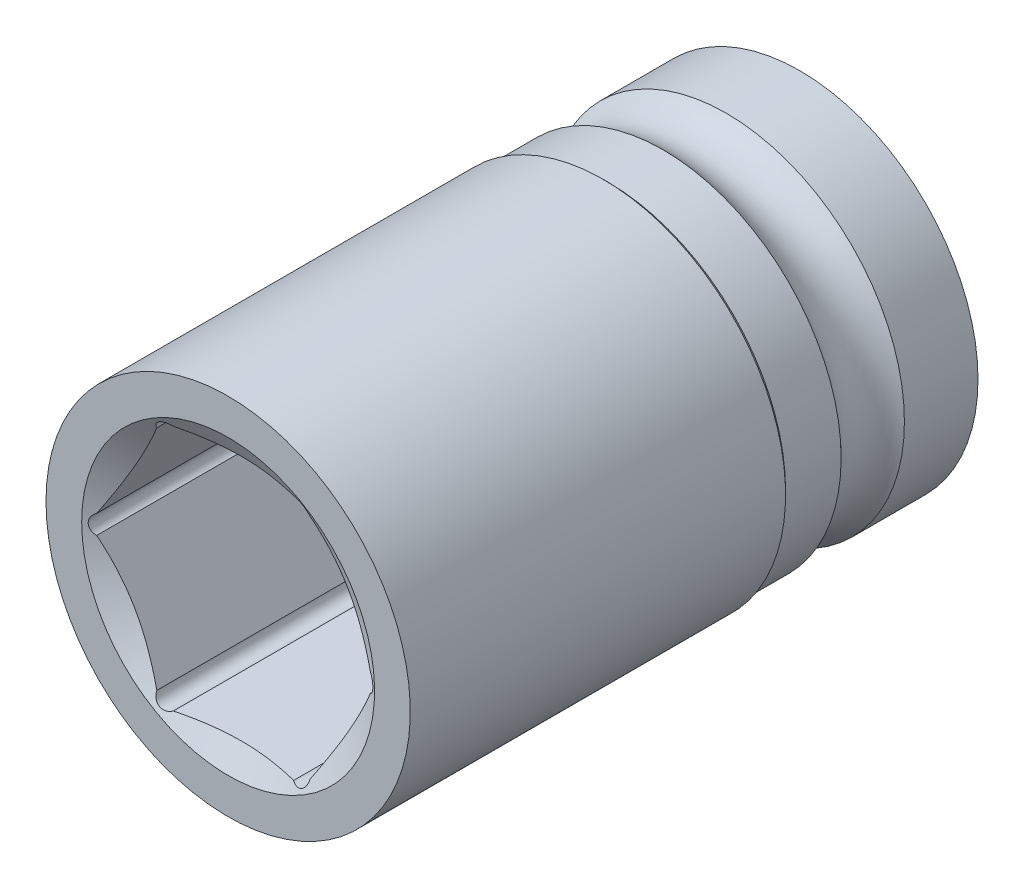
from build123d import *

# Parameters (mm, degrees)
CUT_EXTRUDE1_DEPTH = 33.1
SKETCH3_R          = 10
CUT_EXTRUDE2_DEPTH = 30
CUT_EXTRUDE3_DEPTH = 31.3
SKETCH5_R          = 15
CUT_EXTRUDE4_DEPTH = 8


with BuildPart() as part:
    # Sketch1 → Revolve1 (revolve)
    with BuildSketch(Plane(origin=(0, 0, 0), x_dir=(0, 0, -1), z_dir=(1, 0, 0)), mode=Mode.PRIVATE) as revolve1_sk:
        with BuildLine():
            Line((0, 24.75), (0, 19.9))
            Line((0, 19.9), (11.489270357, 0))
            Line((11.489270357, 0), (66.730344885, 0))
            Line((66.730344885, 0), (77.7, 19))
            Line((77.7, 19), (77.7, 24.2))
            Line((77.7, 24.2), (67.7, 24.2))
            ThreePointArc((67.7, 24.2), (63.4, 22.275), (59.1, 24.2))
            Line((59.1, 24.2), (51.55, 24.2))
            Line((51.55, 24.2), (51, 24.75))
            Line((51, 24.75), (0, 24.75))
        make_face()
    revolve(revolve1_sk.sketch.rotate(Axis((0, 0, 0), (0, 0, 1)), 90), axis=Axis((0, 0, 0), (0, 0, 1)))

    # Sketch2 → Cut-Extrude1 (cut)
    with BuildSketch(Plane.XY):
        with BuildLine():
            Line((-10.420617009, 15.450961894), (-18.591234018, 1.299038106))
            ThreePointArc((-18.591234018, 1.299038106), (-19.341234018, 0), (-18.591234018, -1.299038106))
            Line((-18.591234018, -1.299038106), (-10.420617009, -15.450961894))
            ThreePointArc((-10.420617009, -15.450961894), (-9.670617009, -16.75), (-8.170617009, -16.75))
            Line((-8.170617009, -16.75), (8.170617009, -16.75))
            ThreePointArc((8.170617009, -16.75), (9.670617009, -16.75), (10.420617009, -15.450961894))
            Line((10.420617009, -15.450961894), (18.591234018, -1.299038106))
            ThreePointArc((18.591234018, -1.299038106), (19.341234018, 0), (18.591234018, 1.299038106))
            Line((18.591234018, 1.299038106), (10.420617009, 15.450961894))
            ThreePointArc((10.420617009, 15.450961894), (9.670617009, 16.75), (8.170617009, 16.75))
            Line((8.170617009, 16.75), (-8.170617009, 16.75))
            ThreePointArc((-8.170617009, 16.75), (-9.670617009, 16.75), (-10.420617009, 15.450961894))
        make_face()
    extrude(amount=-CUT_EXTRUDE1_DEPTH, mode=Mode.SUBTRACT)

    # Sketch3 → Cut-Extrude2 (cut)
    with BuildSketch(Plane.XY.offset(-33.1)):
        Circle(SKETCH3_R)
    extrude(amount=-CUT_EXTRUDE2_DEPTH, mode=Mode.SUBTRACT)

    # Sketch4 → Cut-Extrude3 (cut)
    with BuildSketch(Plane(origin=(0, 0, -77.7), x_dir=(-1, 0, 0), z_dir=(0, 0, -1))):
        with BuildLine():
            Line((-12.85, -9.668019485), (-12.85, 9.668019485))
            ThreePointArc((-12.85, 9.668019485), (-12.85, 12.85), (-9.668019485, 12.85))
            Line((-9.668019485, 12.85), (9.668019485, 12.85))
            ThreePointArc((9.668019485, 12.85), (12.85, 12.85), (12.85, 9.668019485))
            Line((12.85, 9.668019485), (12.85, -9.668019485))
            ThreePointArc((12.85, -9.668019485), (12.85, -12.85), (9.668019485, -12.85))
            Line((9.668019485, -12.85), (-9.668019485, -12.85))
            ThreePointArc((-9.668019485, -12.85), (-12.85, -12.85), (-12.85, -9.668019485))
        make_face()
    extrude(amount=-CUT_EXTRUDE3_DEPTH, mode=Mode.SUBTRACT)

    # Sketch5 → Cut-Extrude4 (cut)
    with BuildSketch(Plane.XY.offset(-33.1)):
        Circle(SKETCH5_R)
    extrude(amount=-CUT_EXTRUDE4_DEPTH, mode=Mode.SUBTRACT)


solid = part.part
